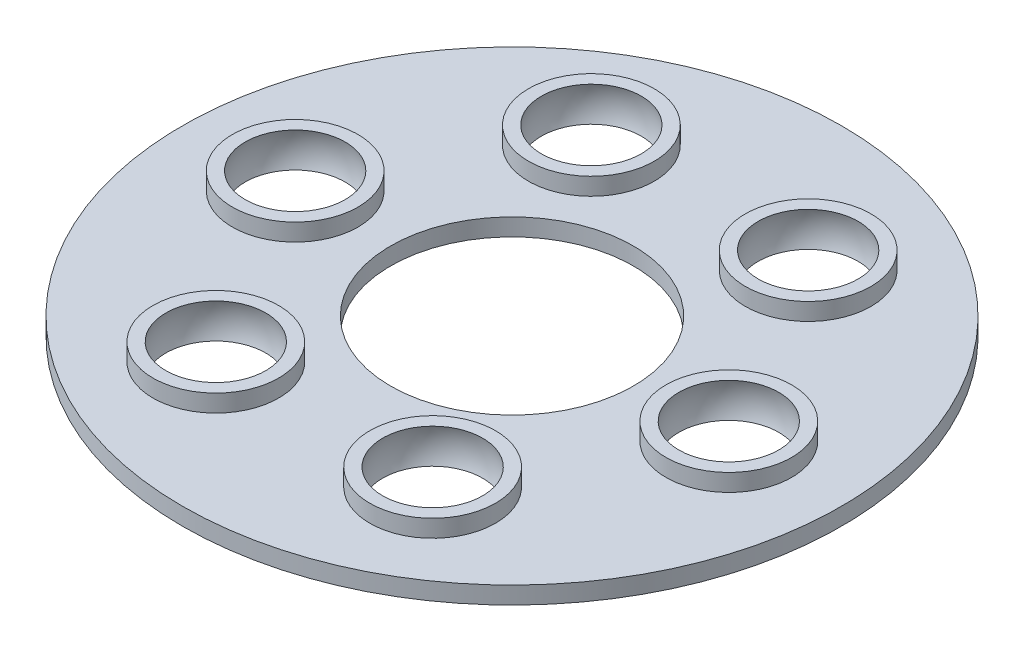
from build123d import *

# Parameters (mm, degrees)
SKETCH1_R           = 19
SKETCH1_R_2         = 7
SKETCH1_R_3         = 2.625
BOSS_EXTRUDE1_DEPTH = 1
SKETCH2_R           = 3.625
SKETCH2_R_2         = 2.625
EXTRUDE_THIN1_DEPTH = 1
CIRPATTERN1_COUNT   = 6


with BuildPart() as part:
    # Sketch1 → Boss-Extrude1 (new body)
    with BuildSketch(Plane(origin=(0, 0, 0), x_dir=(1, 0, 0), z_dir=(0, 1, 0))):
        with Locations(Location((0, 0, 0), (0, 0, 270))):
            Circle(SKETCH1_R)
        with Locations(Location((0, 0, 0), (0, 0, 270))):
            Circle(SKETCH1_R_2, mode=Mode.SUBTRACT)
        with Locations(Location((-12.5, 0, 0), (0, 0, 270))):
            Circle(SKETCH1_R_3, mode=Mode.SUBTRACT)
        with Locations(Location((-6.25, 10.825317547, 0), (0, 0, 270))):
            Circle(SKETCH1_R_3, mode=Mode.SUBTRACT)
        with Locations(Location((6.25, 10.825317547, 0), (0, 0, 270))):
            Circle(SKETCH1_R_3, mode=Mode.SUBTRACT)
        with Locations(Location((12.5, 0, 0), (0, 0, 270))):
            Circle(SKETCH1_R_3, mode=Mode.SUBTRACT)
        with Locations(Location((6.25, -10.825317547, 0), (0, 0, 270))):
            Circle(SKETCH1_R_3, mode=Mode.SUBTRACT)
        with Locations(Location((-6.25, -10.825317547, 0), (0, 0, 270))):
            Circle(SKETCH1_R_3, mode=Mode.SUBTRACT)
    extrude(amount=BOSS_EXTRUDE1_DEPTH)

    # Sketch2 → Extrude-Thin1 (add)
    with BuildSketch(Plane(origin=(0, 1, 0), x_dir=(1, 0, 0), z_dir=(0, 1, 0))):
        with Locations((-12.5, 0)):
            Circle(SKETCH2_R)
        with Locations((-12.5, 0)):
            Circle(SKETCH2_R_2, mode=Mode.SUBTRACT)
    extrude_thin1 = extrude(amount=EXTRUDE_THIN1_DEPTH)

    # Sketch3 → Cut-Revolve1 (revolve, cut)
    with BuildSketch(Plane(origin=(0, 1, 0), x_dir=(1, 0, 0), z_dir=(0, 1, 0))):
        with BuildLine():
            Line((-9.45, 0), (-15.55, 0))
            ThreePointArc((-15.55, 0), (-12.5, 3.05), (-9.45, 0))
        make_face()
    cut_revolve1 = revolve(axis=Axis((-9.45, 1, 0), (-1, 0, 0)), mode=Mode.SUBTRACT)

    # CirPattern1: Extrude-Thin1, Cut-Revolve1 ×6 about axis
    cirpattern1_axis = Axis((0, 0, 0), (0, 1, 0))
    add([extrude_thin1.rotate(cirpattern1_axis, i * 360 / CIRPATTERN1_COUNT) for i in range(1, CIRPATTERN1_COUNT)])
    add([cut_revolve1.rotate(cirpattern1_axis, i * 360 / CIRPATTERN1_COUNT) for i in range(1, CIRPATTERN1_COUNT)], mode=Mode.SUBTRACT)


solid = part.part
